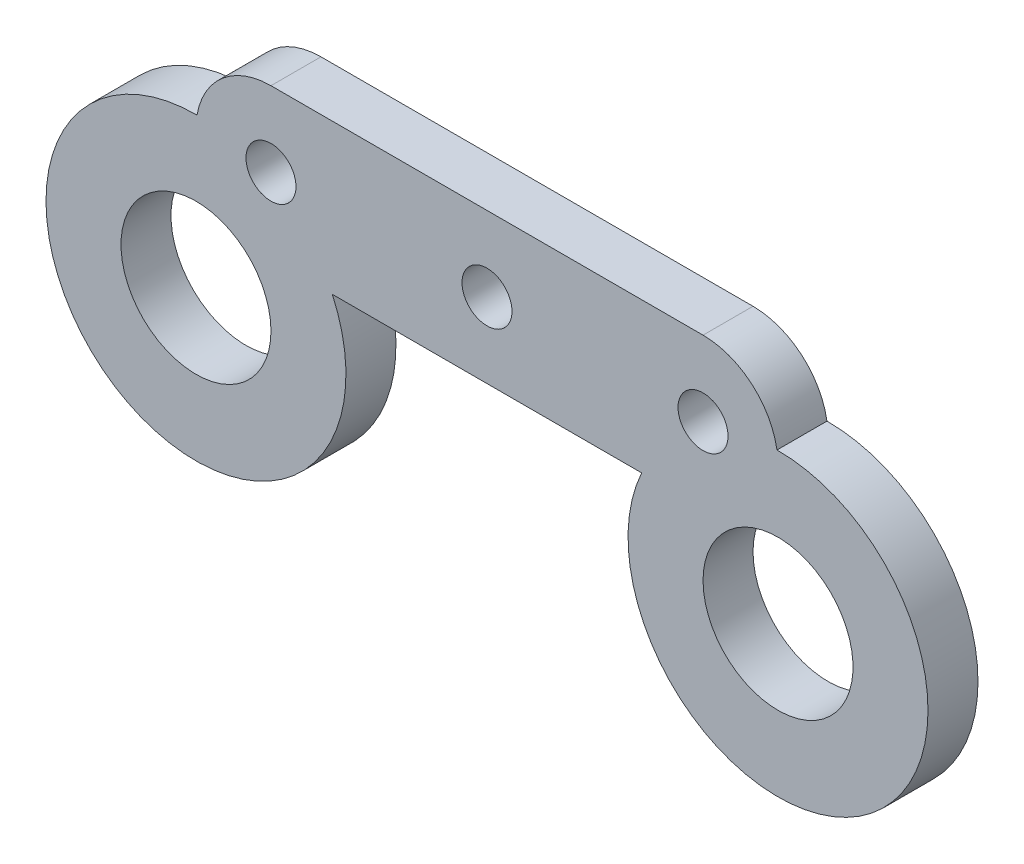
from build123d import *

# Parameters (mm, degrees)
SKETCH1_R           = 3
SKETCH1_R_2         = 1
BOSS_EXTRUDE1_DEPTH = 2
SKETCH2_R           = 0.5
CUT_EXTRUDE1_DEPTH  = 0.5


with BuildPart() as part:
    # Sketch1 → Boss-Extrude1 (new body)
    with BuildSketch(Plane.XY):
        with BuildLine():
            Line((-8.642138301, 3), (8.642138301, 3))
            ThreePointArc((8.642138301, 3), (10.578686732, 2.291239877), (11.600202961, 0.49985345))
            ThreePointArc((11.600202961, 0.49985345), (14.900135896, -10.538397729), (6.187782244, -3))
            Line((6.187782244, -3), (-6.187782244, -3))
            ThreePointArc((-6.187782244, -3), (-14.900135896, -10.538397729), (-11.600202961, 0.49985345))
            ThreePointArc((-11.600202961, 0.49985345), (-10.578686732, 2.291239877), (-8.642138301, 3))
        make_face()
        with Locations((-11.642138301, -5.5)):
            Circle(SKETCH1_R, mode=Mode.SUBTRACT)
        with Locations(Location((11.642138301, -5.5, 0), (0, 0, 180))):
            Circle(SKETCH1_R, mode=Mode.SUBTRACT)
        with Locations(Location((8.642138301, 0, 0), (0, 0, 180))):
            Circle(SKETCH1_R_2, mode=Mode.SUBTRACT)
        with Locations((-8.642138301, 0)):
            Circle(SKETCH1_R_2, mode=Mode.SUBTRACT)
        Circle(SKETCH1_R_2, mode=Mode.SUBTRACT)
    extrude(amount=BOSS_EXTRUDE1_DEPTH)

    # Sketch2 → Cut-Extrude1 (cut)
    with BuildSketch(Plane.XZ.offset(3)):
        with Locations(Location((0, 1, 0), (0, 0, 270))):
            Circle(SKETCH2_R)
    extrude(amount=-CUT_EXTRUDE1_DEPTH, mode=Mode.SUBTRACT)


solid = part.part
